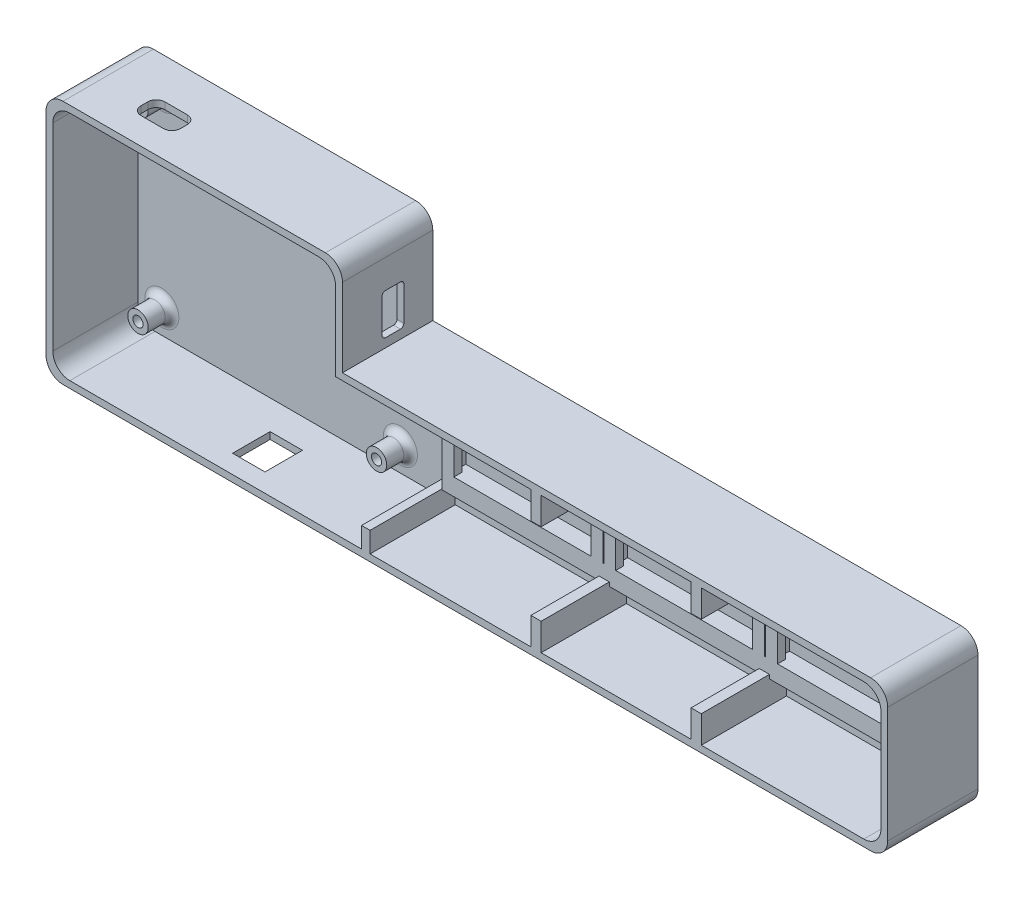
from build123d import *

# Parameters (mm, degrees)
EXTRUDE_1_DEPTH     = 1.5
EXTRUDE_2_DEPTH     = 25
FILLET_1_R          = 5
SKETCH_3_R          = 3
SKETCH_3_R_2        = 1.5
EXTRUDE_3_DEPTH     = 7
FILLET_2_R          = 2
CUT_EXTRUDE_1_REACH = 182.017
SKETCH_4_W          = 6.382937609
SKETCH_4_H          = 12
FILLET_3_R          = 1
CUT_EXTRUDE_2_REACH = 256.311
SKETCH_5_W          = 11.6
SKETCH_5_H          = 7
FILLET_4_R          = 2.5
SKETCH_6_W          = 145
SKETCH_6_H          = 5
EXTRUDE_4_DEPTH     = 5
EXTRUDE_5_REACH     = 249.47
CUT_EXTRUDE_3_REACH = 256.311
SKETCH_8_W          = 9.5
SKETCH_8_H          = 11
SKETCH_9_W          = 3
SKETCH_9_H          = 8
SKETCH_9_W_2        = 2.5
SKETCH_9_H_2        = 6
EXTRUDE_6_DEPTH     = 25


with BuildPart() as part:
    # 草图1 → 凸台-拉伸1 (new body)
    with BuildSketch(Plane.XY):
        Polygon((104.053507175, -78.126332489), (-4.538088534, -78.126332489), (-4.538088534, -6.126332489), (82.461911466, -6.126332489), (82.461911466, -34.126332489), (242.461911466, -34.126332489), (242.461911466, -78.126332489), align=None)
    extrude(amount=EXTRUDE_1_DEPTH)

    # 草图2 → 凸台-拉伸2 (add)
    with BuildSketch(Plane.XY.offset(1.5)):
        Polygon((-4.538088534, -6.126332489), (-4.538088534, -78.126332489), (242.461911466, -78.126332489), (242.461911466, -34.126332489), (82.461911466, -34.126332489), (82.461911466, -6.126332489), align=None)
        Polygon((80.461911466, -8.126332489), (-2.538088534, -8.126332489), (-2.538088534, -76.126332489), (240.461911466, -76.126332489), (240.461911466, -36.126332489), (80.461911466, -36.126332489), align=None, mode=Mode.SUBTRACT)
    extrude(amount=EXTRUDE_2_DEPTH)

    # 圆角1
    fillet_1_edges = [part.edges().sort_by_distance(p)[0] for p in [
        (-4.538088534, -6.126332489, 13.25),
        (82.461911466, -6.126332489, 13.25),
        (242.461911466, -34.126332489, 13.25),
        (242.461911466, -78.126332489, 13.25),
        (-4.538088534, -78.126332489, 13.25),
        (80.461911466, -8.126332489, 14),
        (-2.538088534, -8.126332489, 14),
        (-2.538088534, -76.126332489, 14),
        (240.461911466, -76.126332489, 14),
        (240.461911466, -36.126332489, 14),
    ]]
    fillet(fillet_1_edges, radius=FILLET_1_R)

    # 草图3 → 凸台-拉伸3 (add)
    # profile 1 of 4: a face of its own
    with BuildSketch(Plane.XY.offset(1.5)):
        with Locations((74.461811484, -14.126255575)):
            Circle(SKETCH_3_R)
        with Locations((74.461811484, -14.126255575)):
            Circle(SKETCH_3_R_2, mode=Mode.SUBTRACT)
    # profile 2 of 4: a face of its own
    with BuildSketch(Plane.XY.offset(1.5)):
        with Locations((4.461811484, -14.126255575)):
            Circle(SKETCH_3_R)
        with Locations((4.461811484, -14.126255575)):
            Circle(SKETCH_3_R_2, mode=Mode.SUBTRACT)
    # profile 3 of 4: a face of its own
    with BuildSketch(Plane.XY.offset(1.5)):
        with Locations((4.461811484, -69.126255575)):
            Circle(SKETCH_3_R)
        with Locations((4.461811484, -69.126255575)):
            Circle(SKETCH_3_R_2, mode=Mode.SUBTRACT)
    # profile 4 of 4: a face of its own
    with BuildSketch(Plane.XY.offset(1.5)):
        with Locations((74.461811484, -69.126255575)):
            Circle(SKETCH_3_R)
        with Locations((74.461811484, -69.126255575)):
            Circle(SKETCH_3_R_2, mode=Mode.SUBTRACT)
    extrude(amount=EXTRUDE_3_DEPTH)

    # 圆角2
    fillet_2_edges = [part.edges().sort_by_distance(p)[0] for p in [
        (71.461811484, -69.126255575, 1.5),
        (1.461811484, -69.126255575, 1.5),
        (1.461811484, -14.126255575, 1.5),
        (71.461811484, -14.126255575, 1.5),
    ]]
    fillet(fillet_2_edges, radius=FILLET_2_R)

    # 草图4 → 切除-拉伸1 (cut, up to next)
    with BuildSketch(Plane(origin=(82.461911466, 0, 0), x_dir=(0, 0, -1), z_dir=(1, 0, 0)), mode=Mode.PRIVATE) as cut_extrude_1_sk1:
        with Locations((-11.691468805, -25.526333622)):
            Rectangle(SKETCH_4_W, SKETCH_4_H)
    cut_extrude_1_tool1 = extrude(cut_extrude_1_sk1.sketch, amount=-CUT_EXTRUDE_1_REACH, mode=Mode.PRIVATE) & part.part
    add(cut_extrude_1_tool1.solids().sort_by_distance((82.461911, -25.526334, 11.691469))[0], mode=Mode.SUBTRACT)

    # 圆角3
    fillet_3_edges = [part.edges().sort_by_distance(p)[0] for p in [
        (81.461911466, -19.526333622, 8.5),
        (81.461911466, -31.526333622, 8.5),
        (81.461911466, -31.526333622, 14.882937609),
        (81.461911466, -19.526333622, 14.882937609),
    ]]
    fillet(fillet_3_edges, radius=FILLET_3_R)

    # 草图5 → 切除-拉伸2 (cut, up to next)
    with BuildSketch(Plane(origin=(0, -6.126332489, 0), x_dir=(1, 0, 0), z_dir=(0, 1, 0)), mode=Mode.PRIVATE) as cut_extrude_2_sk1:
        with Locations((18.833572944, -15.2)):
            Rectangle(SKETCH_5_W, SKETCH_5_H)
    cut_extrude_2_tool1 = extrude(cut_extrude_2_sk1.sketch, amount=-CUT_EXTRUDE_2_REACH, mode=Mode.PRIVATE) & part.part
    add(cut_extrude_2_tool1.solids().sort_by_distance((18.833573, -6.126332, 15.2))[0], mode=Mode.SUBTRACT)

    # 圆角4
    fillet_4_edges = [part.edges().sort_by_distance(p)[0] for p in [
        (24.633572944, -7.126332489, 11.7),
        (24.633572944, -7.126332489, 18.7),
        (13.033572944, -7.126332489, 18.7),
        (13.033572944, -7.126332489, 11.7),
    ]]
    fillet(fillet_4_edges, radius=FILLET_4_R)

    # 草图6 → 凸台-拉伸4 (add)
    with BuildSketch(Plane.XY.offset(1.5)):
        with Locations((164.146026619, -45.476332489)):
            Rectangle(SKETCH_6_W, SKETCH_6_H)
        with Locations((164.146026619, -66.776332489)):
            Rectangle(SKETCH_6_W, SKETCH_6_H)
    extrude(amount=EXTRUDE_4_DEPTH)

    # 草图7 → 凸台-拉伸5 (add, up to next)
    with BuildSketch(Plane.XZ.offset(47.976332489), mode=Mode.PRIVATE) as extrude_5_sk1:
        Polygon((91.646026619, 6.5), (95.146026619, 6.5), (95.146026619, 4.15), (93.646026619, 4.15), (93.646026619, 1.5), (91.646026619, 1.5), align=None)
    extrude_5_tool1 = extrude(extrude_5_sk1.sketch, amount=EXTRUDE_5_REACH, mode=Mode.PRIVATE) - part.part
    # 草图7 → 凸台-拉伸5 (add, up to next)
    with BuildSketch(Plane.XZ.offset(47.976332489), mode=Mode.PRIVATE) as extrude_5_sk2:
        Polygon((138.846026619, 1.5), (138.846026619, 6.5), (135.346026619, 6.5), (135.346026619, 4.15), (136.846026619, 4.15), (136.846026619, 1.5), align=None)
    extrude_5_tool2 = extrude(extrude_5_sk2.sketch, amount=EXTRUDE_5_REACH, mode=Mode.PRIVATE) - part.part
    # 草图7 → 凸台-拉伸5 (add, up to next)
    with BuildSketch(Plane.XZ.offset(47.976332489), mode=Mode.PRIVATE) as extrude_5_sk3:
        Polygon((139.146026619, 1.5), (139.146026619, 6.5), (142.646026619, 6.5), (142.646026619, 4.15), (141.146026619, 4.15), (141.146026619, 1.5), align=None)
    extrude_5_tool3 = extrude(extrude_5_sk3.sketch, amount=EXTRUDE_5_REACH, mode=Mode.PRIVATE) - part.part
    # 草图7 → 凸台-拉伸5 (add, up to next)
    with BuildSketch(Plane.XZ.offset(47.976332489), mode=Mode.PRIVATE) as extrude_5_sk4:
        Polygon((186.346026619, 1.5), (186.346026619, 6.5), (182.846026619, 6.5), (182.846026619, 4.15), (184.346026619, 4.15), (184.346026619, 1.5), align=None)
    extrude_5_tool4 = extrude(extrude_5_sk4.sketch, amount=EXTRUDE_5_REACH, mode=Mode.PRIVATE) - part.part
    # 草图7 → 凸台-拉伸5 (add, up to next)
    with BuildSketch(Plane.XZ.offset(47.976332489), mode=Mode.PRIVATE) as extrude_5_sk5:
        Polygon((186.646026619, 1.5), (186.646026619, 6.5), (190.146026619, 6.5), (190.146026619, 4.15), (188.646026619, 4.15), (188.646026619, 1.5), align=None)
    extrude_5_tool5 = extrude(extrude_5_sk5.sketch, amount=EXTRUDE_5_REACH, mode=Mode.PRIVATE) - part.part
    # 草图7 → 凸台-拉伸5 (add, up to next)
    with BuildSketch(Plane.XZ.offset(47.976332489), mode=Mode.PRIVATE) as extrude_5_sk6:
        Polygon((233.846026619, 1.5), (233.846026619, 6.5), (230.346026619, 6.5), (230.346026619, 4.15), (231.846026619, 4.15), (231.846026619, 1.5), align=None)
    extrude_5_tool6 = extrude(extrude_5_sk6.sketch, amount=EXTRUDE_5_REACH, mode=Mode.PRIVATE) - part.part
    add(extrude_5_tool1.solids().sort_by_distance((93.102126, -47.976332, 4.345333))[0])
    add(extrude_5_tool2.solids().sort_by_distance((137.389927, -47.976332, 4.345333))[0])
    add(extrude_5_tool3.solids().sort_by_distance((140.602126, -47.976332, 4.345333))[0])
    add(extrude_5_tool4.solids().sort_by_distance((184.889927, -47.976332, 4.345333))[0])
    add(extrude_5_tool5.solids().sort_by_distance((188.102126, -47.976332, 4.345333))[0])
    add(extrude_5_tool6.solids().sort_by_distance((232.389927, -47.976332, 4.345333))[0])

    # 草图8 → 切除-拉伸3 (cut, up to next)
    with BuildSketch(Plane.XZ.offset(78.126332489), mode=Mode.PRIVATE) as cut_extrude_3_sk1:
        with Locations((49.541967888, 15.57020515)):
            Rectangle(SKETCH_8_W, SKETCH_8_H)
    cut_extrude_3_tool1 = extrude(cut_extrude_3_sk1.sketch, amount=-CUT_EXTRUDE_3_REACH, mode=Mode.PRIVATE) & part.part
    add(cut_extrude_3_tool1.solids().sort_by_distance((49.541968, -78.126332, 15.570205))[0], mode=Mode.SUBTRACT)

    # 草图9 → 凸台-拉伸6 (add)
    with BuildSketch(Plane.XY.offset(1.5)):
        with Locations((139.260338635, -40.126332489)):
            Rectangle(SKETCH_9_W, SKETCH_9_H)
        with Locations((139.260338635, -72.126332489)):
            Rectangle(SKETCH_9_W, SKETCH_9_H)
        with Locations((186.260338635, -40.126332489)):
            Rectangle(SKETCH_9_W, SKETCH_9_H)
        with Locations((186.260338635, -72.126332489)):
            Rectangle(SKETCH_9_W, SKETCH_9_H)
        with Locations((89.301714301, -73.126332489)):
            Rectangle(SKETCH_9_W_2, SKETCH_9_H_2)
    extrude(amount=EXTRUDE_6_DEPTH)


solid = part.part
